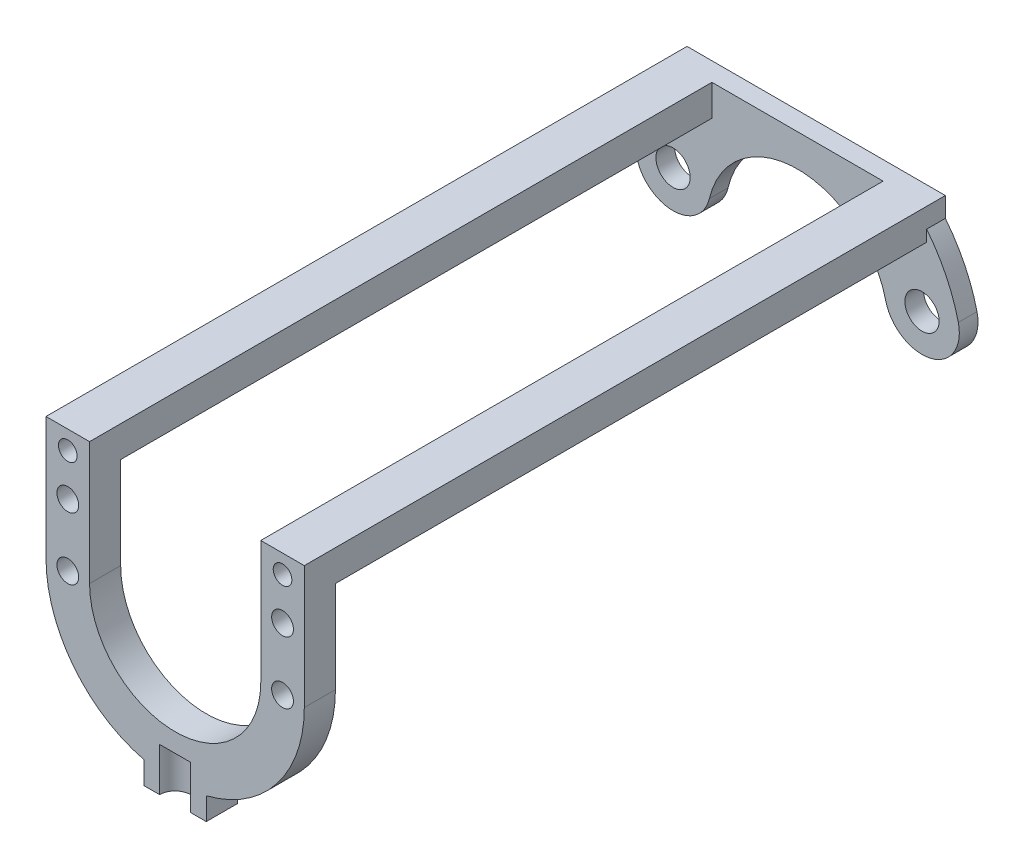
from build123d import *

# Parameters (mm, degrees)
SKETCH2_R           = 2.75
BOSS_EXTRUDE1_DEPTH = 3
SKETCH3_W           = 7
SKETCH3_H           = 5
BOSS_EXTRUDE2_DEPTH = 100
BOSS_EXTRUDE3_DEPTH = 5
SKETCH5_R           = 1.75
CUT_EXTRUDE1_DEPTH  = 5
SKETCH6_R           = 1.5
CUT_EXTRUDE2_DEPTH  = 5
SKETCH7_R           = 2.5
CUT_EXTRUDE3_DEPTH  = 7


with BuildPart() as part:
    # Sketch2 → Boss-Extrude1 (new body)
    with BuildSketch(Plane.XY):
        with BuildLine():
            Line((-20.753194099, 19.75), (-20.753194099, 16.569349275))
            ThreePointArc((-20.753194099, 16.569349275), (-23.872314522, 11.634044872), (-25.837619304, 6.136434585))
            ThreePointArc((-25.837619304, 6.136434585), (-21.386434585, -1.087619304), (-14.162380696, 3.363565415))
            ThreePointArc((-14.162380696, 3.363565415), (0, 14.556325061), (14.162380696, 3.363565415))
            ThreePointArc((14.162380696, 3.363565415), (21.386434585, -1.087619304), (25.837619304, 6.136434585))
            ThreePointArc((25.837619304, 6.136434585), (23.872314522, 11.634044872), (20.753194099, 16.569349275))
            Line((20.753194099, 16.569349275), (20.753194099, 19.75))
            Line((20.753194099, 19.75), (0, 19.75))
            Line((0, 19.75), (-20.753194099, 19.75))
        make_face()
        with Locations((-20, 4.75)):
            Circle(SKETCH2_R, mode=Mode.SUBTRACT)
        with Locations((20, 4.75)):
            Circle(SKETCH2_R, mode=Mode.SUBTRACT)
    extrude(amount=BOSS_EXTRUDE1_DEPTH)

    # Sketch3 → Boss-Extrude2 (add)
    with BuildSketch(Plane.XY.offset(3)):
        with Locations((-17.253194099, 17.25)):
            Rectangle(SKETCH3_W, SKETCH3_H)
        with Locations((17.253194099, 17.25)):
            Rectangle(SKETCH3_W, SKETCH3_H)
    extrude(amount=BOSS_EXTRUDE2_DEPTH)

    # Sketch4 → Boss-Extrude3 (add)
    with BuildSketch(Plane.XY.offset(103)):
        with BuildLine():
            Line((20.753194099, 19.75), (13.753194099, 19.75))
            Line((13.753194099, 19.75), (13.753194099, 0))
            ThreePointArc((13.753194099, 0), (0, -13.753194099), (-13.753194099, 0))
            Line((-13.753194099, 0), (-13.753194099, 19.75))
            Line((-13.753194099, 19.75), (-20.753194099, 19.75))
            Line((-20.753194099, 19.75), (-20.753194099, 0))
            ThreePointArc((-20.753194099, 0), (-16.34718685, -12.785325472), (-5, -20.141873431))
            Line((-5, -20.141873431), (-5, -23.753194099))
            Line((-5, -23.753194099), (5, -23.753194099))
            Line((5, -23.753194099), (5, -20.141873431))
            ThreePointArc((5, -20.141873431), (16.34718685, -12.785325472), (20.753194099, 0))
            Line((20.753194099, 0), (20.753194099, 19.75))
        make_face()
    extrude(amount=-BOSS_EXTRUDE3_DEPTH)

    # Sketch5 → Cut-Extrude1 (cut)
    with BuildSketch(Plane.XY.offset(103)):
        with Locations((-17.253194099, 10)):
            Circle(SKETCH5_R)
        with Locations((17.253194099, 10)):
            Circle(SKETCH5_R)
        with BuildLine():
            ThreePointArc((19.003194099, 0), (17.253194099, 1.75), (15.503194099, 0))
            Line((15.503194099, 0), (19.003194099, 0))
        make_face()
        with BuildLine():
            Line((19.003194099, 0), (15.503194099, 0))
            ThreePointArc((15.503194099, 0), (17.253194099, -1.75), (19.003194099, 0))
        make_face()
        with BuildLine():
            ThreePointArc((-19.003194099, 0), (-17.253194099, -1.75), (-15.503194099, 0))
            Line((-15.503194099, 0), (-19.003194099, 0))
        make_face()
        with BuildLine():
            Line((-19.003194099, 0), (-15.503194099, 0))
            ThreePointArc((-15.503194099, 0), (-17.253194099, 1.75), (-19.003194099, 0))
        make_face()
    extrude(amount=-CUT_EXTRUDE1_DEPTH, mode=Mode.SUBTRACT)

    # Sketch6 → Cut-Extrude2 (cut)
    with BuildSketch(Plane.XY.offset(103)):
        with Locations((-17.253194099, 16.75)):
            Circle(SKETCH6_R)
        with Locations((17.253194099, 16.75)):
            Circle(SKETCH6_R)
    extrude(amount=-CUT_EXTRUDE2_DEPTH, mode=Mode.SUBTRACT)

    # Sketch7 → Cut-Extrude3 (cut)
    with BuildSketch(Plane.XZ.offset(23.753194099)):
        with Locations((0, 103)):
            Circle(SKETCH7_R)
    extrude(amount=-CUT_EXTRUDE3_DEPTH, mode=Mode.SUBTRACT)


solid = part.part
